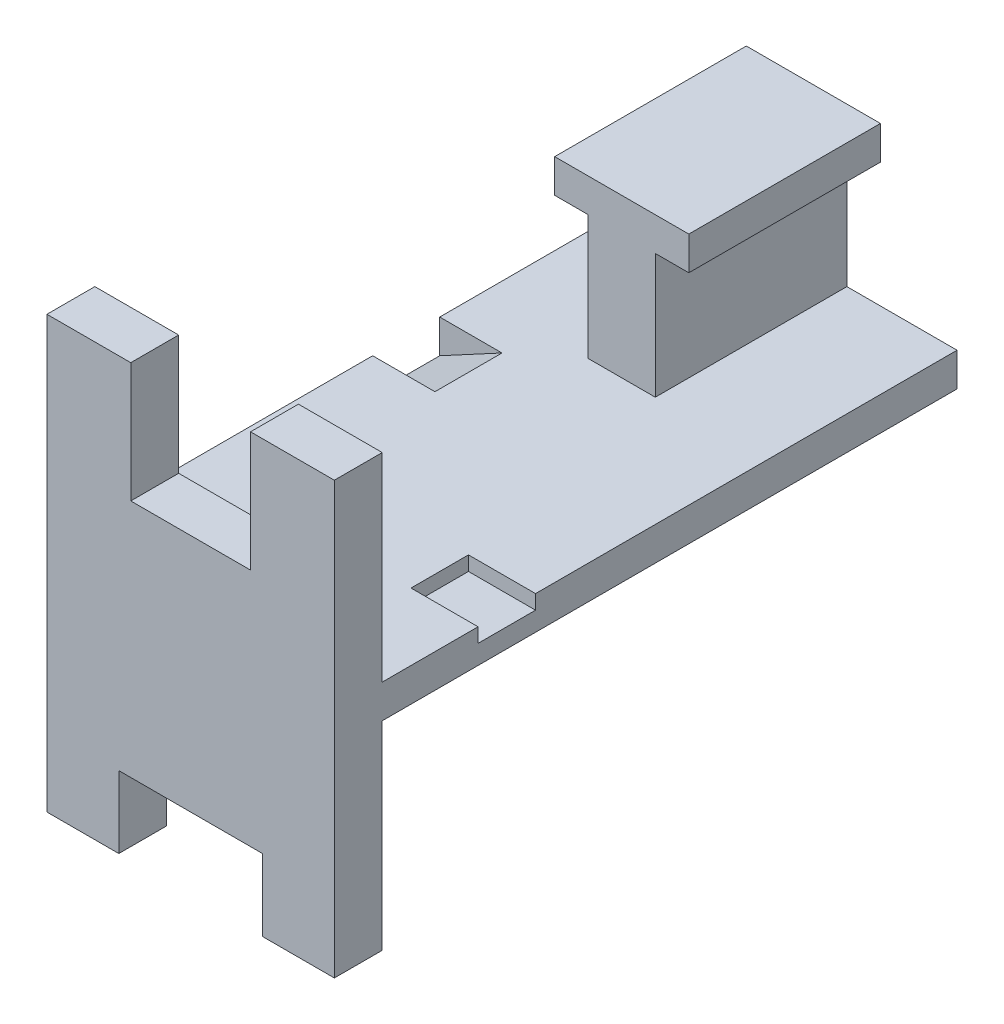
from build123d import *

# Parameters (mm, degrees)
EXTRUDE_1_DEPTH     = 120
CUT_EXTRUDE_1_REACH = 132
SKETCH_3_W          = 14
SKETCH_3_H          = 80
SKETCH_4_W          = 60
SKETCH_4_H          = 7
EXTRUDE_3_DEPTH     = 10
SKETCH_5_W          = 14
SKETCH_5_H          = 12
CUT_EXTRUDE_2_DEPTH = 3
CUT_EXTRUDE_START   = -48
CUT_EXTRUDE_3_DEPTH = 14


with BuildPart() as part:
    # Эскиз1 → Бобышка-Вытянуть1 (new body)
    with BuildSketch(Plane.XY):
        Polygon((7, 7), (7, 33), (14, 33), (14, 40), (0, 40), (0, 0), (30, 0), (30, 7), (23, 7), align=None)
    extrude_1 = extrude(amount=EXTRUDE_1_DEPTH)

    # Вырез-Вытянуть1: up to this face of the body (flat: up to its plane)
    cut_extrude_1_end = Plane(part.part.faces().sort_by_distance((18.5, 7, 60))[0])
    # Эскиз3 → Вырез-Вытянуть1 (cut, up to the picked face)
    with BuildSketch(Plane(origin=(0, 40, 0), x_dir=(1, 0, 0), z_dir=(0, 1, 0)), mode=Mode.PRIVATE) as cut_extrude_1_sk1:
        with Locations((7, -80)):
            Rectangle(SKETCH_3_W, SKETCH_3_H)
    cut_extrude_1_tool1 = split(extrude(cut_extrude_1_sk1.sketch, amount=-CUT_EXTRUDE_1_REACH, mode=Mode.PRIVATE), bisect_by=cut_extrude_1_end, keep=Keep.BOTH, mode=Mode.PRIVATE)
    cut_extrude_1 = cut_extrude_1_tool1.solids().sort_by(Axis((7, 40, 80), (0, -1, 0)))[0]
    add(cut_extrude_1, mode=Mode.SUBTRACT)

    # Зеркальное отражение1: Бобышка-Вытянуть1, Вырез-Вытянуть1 across plane
    add(extrude_1.mirror(Plane(origin=(0, 0, 120), x_dir=(0, 0, 1), z_dir=(-1, 0, 0))))
    add(cut_extrude_1.mirror(Plane(origin=(0, 0, 120), x_dir=(0, 0, 1), z_dir=(-1, 0, 0))), mode=Mode.SUBTRACT)

    # Эскиз4 → Бобышка-Вытянуть3 (add)
    with BuildSketch(Plane.XY.offset(120)):
        Polygon((-30, 0), (-30, -41.5), (-15, -41.5), (-15, -26.5), (15, -26.5), (15, -41.5), (30, -41.5), (30, 0), align=None)
        Polygon((-30, 48.5), (-30, 7), (30, 7), (30, 48.5), (12.5, 48.5), (12.5, 23.5), (-12.5, 23.5), (-12.5, 48.5), align=None)
        with Locations((0, 3.5)):
            Rectangle(SKETCH_4_W, SKETCH_4_H)
    extrude(amount=EXTRUDE_3_DEPTH)

    # Эскиз5 → Вырез-Вытянуть2 (cut)
    with BuildSketch(Plane(origin=(0, 7, 0), x_dir=(1, 0, 0), z_dir=(0, 1, 0))):
        with Locations((23, -94)):
            Rectangle(SKETCH_5_W, SKETCH_5_H)
    extrude(amount=-CUT_EXTRUDE_2_DEPTH, mode=Mode.SUBTRACT)

    # Эскиз6 → Вырез-Вытянуть3 (cut)
    with BuildSketch(Plane(origin=(0, 0, 0), x_dir=(-1, 0, 0), z_dir=(0, 0, -1)).offset(CUT_EXTRUDE_START)):
        Polygon((30, 0), (17, 7), (30, 7), align=None)
    extrude(amount=-CUT_EXTRUDE_3_DEPTH, mode=Mode.SUBTRACT)


solid = part.part
